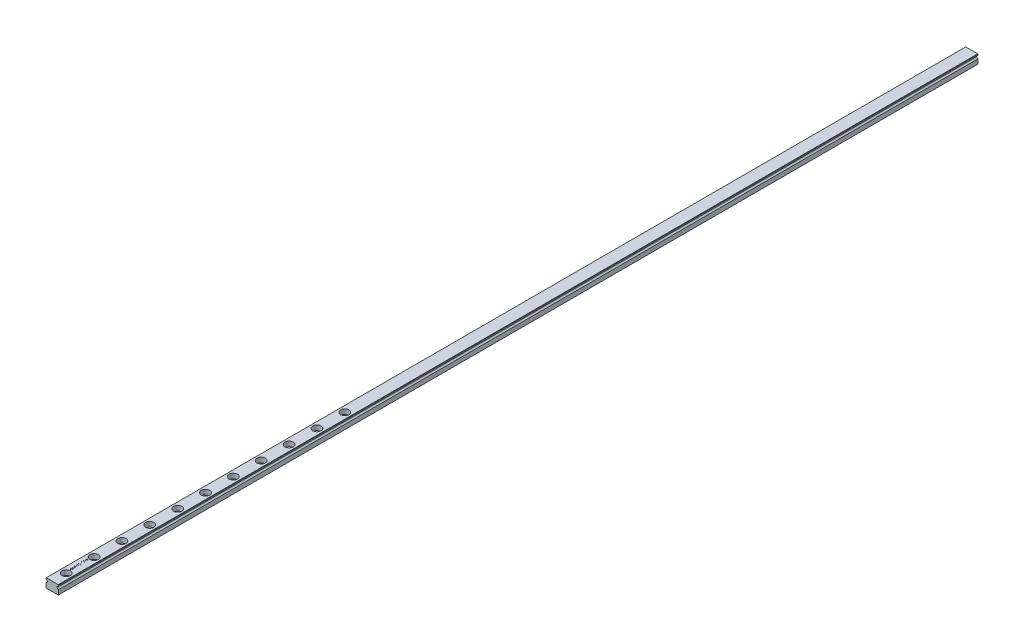
from build123d import *

# Parameters (mm, degrees)
EXTRUDE_1_DEPTH              = 220
HOLE_WIZARD_M3_1_D           = 3.5
HOLE_WIZARD_M3_1_CBORE_D     = 6
HOLE_WIZARD_M3_1_CBORE_DEPTH = 3.5
PATTERN_LINEAR_1_COUNT       = 11
PATTERN_LINEAR_1_PITCH       = 20
SKETCH_6_W                   = 1.5
SKETCH_6_H                   = 0.134615385
CUT_EXTRUDE_1_DEPTH          = 0.1
EXTRUDE_2_DEPTH              = 440


with BuildPart() as part:
    # 草图1 → 凸台-拉伸1 (new body)
    with BuildSketch(Plane.XY):
        with BuildLine():
            Line((4.5, 5.5), (4.5, 6.3))
            Line((4.5, 6.3), (4.3, 6.5))
            Line((4.3, 6.5), (-4.3, 6.5))
            Line((-4.3, 6.5), (-4.5, 6.3))
            Line((-4.5, 6.3), (-4.5, 5.5))
            ThreePointArc((-4.5, 5.5), (-3.5, 4.5), (-4.5, 3.5))
            Line((-4.5, 3.5), (-4.5, 0.2))
            Line((-4.5, 0.2), (-4.3, 0))
            Line((-4.3, 0), (0.2, 0))
            ThreePointArc((0.2, 0), (0.5, 0.3), (0.8, 0))
            Line((0.8, 0), (4.3, 0))
            Line((4.3, 0), (4.5, 0.2))
            Line((4.5, 0.2), (4.5, 3.5))
            ThreePointArc((4.5, 3.5), (3.5, 4.5), (4.5, 5.5))
        make_face()
    extrude(amount=-EXTRUDE_1_DEPTH)

    # M3 六角凹头螺钉的柱形沉头孔1 (through all)
    with Locations(Plane(origin=(0.754900713, 6.5, 19.343475793), x_dir=(-1, 0, 0), z_dir=(0, 1, 0))):
        with Locations((0.754900713, -29.343475793)):
            hole_wizard_m3_1 = CounterBoreHole(HOLE_WIZARD_M3_1_D / 2, HOLE_WIZARD_M3_1_CBORE_D / 2, HOLE_WIZARD_M3_1_CBORE_DEPTH)

    # 阵列(线性)1: M3 六角凹头螺钉的柱形沉头孔1 ×11
    with Locations(*[(0, 0, -i * PATTERN_LINEAR_1_PITCH) for i in range(1, PATTERN_LINEAR_1_COUNT)]):
        add(hole_wizard_m3_1, mode=Mode.SUBTRACT)

    # 草图6 → 切除-拉伸1 (cut)
    # profile 1 of 9: a face of its own
    with BuildSketch(Plane(origin=(0, 6.5, 0), x_dir=(1, 0, 0), z_dir=(0, 1, 0))):
        Polygon((-1.5, 13.740384615), (-1.5, 13.875), (-0.884615385, 13.875), (-0.884615385, 14.644230769), (-1.5, 14.644230769), (-1.5, 14.778846154), (0, 14.778846154), (0, 14.644230769), (-0.730769231, 14.644230769), (-0.730769231, 13.875), (0, 13.875), (0, 13.740384615), align=None)
    # profile 2 of 9: a face of its own
    with BuildSketch(Plane(origin=(0, 6.5, 0), x_dir=(1, 0, 0), z_dir=(0, 1, 0))):
        with Locations((-0.75, 15.230769231)):
            Rectangle(SKETCH_6_W, SKETCH_6_H)
    # profile 3 of 9: a face of its own
    with BuildSketch(Plane(origin=(0, 6.5, 0), x_dir=(1, 0, 0), z_dir=(0, 1, 0))):
        Polygon((-1.5, 15.528846154), (-1.5, 15.66796875), (-0.399939904, 15.961538462), (-1.5, 16.398137019), (-1.5, 16.417668269), (-0.407451923, 16.846153846), (-1.5, 17.141225962), (-1.5, 17.278846154), (0, 16.874399038), (0, 16.855168269), (-1.147235577, 16.403846154), (0, 15.947115385), (0, 15.927884615), align=None)
    # profile 4 of 9: a face of its own
    with BuildSketch(Plane(origin=(0, 6.5, 0), x_dir=(1, 0, 0), z_dir=(0, 1, 0))):
        with Locations((-0.75, 17.692307693)):
            Rectangle(SKETCH_6_W, SKETCH_6_H)
    # profile 5 of 9: a face of its own
    with BuildSketch(Plane(origin=(0, 6.5, 0), x_dir=(1, 0, 0), z_dir=(0, 1, 0))):
        Polygon((0, 18.086538462), (-1.5, 18.086538462), (-1.5, 18.114783654), (-0.319411058, 19.105769231), (-1.5, 19.105769231), (-1.5, 19.240384615), (0, 19.240384615), (0, 19.209735577), (-1.177884615, 18.221153846), (0, 18.221153846), align=None)
    # profile 6 of 9: a face of its own
    with BuildSketch(Plane(origin=(0, 6.5, 0), x_dir=(1, 0, 0), z_dir=(0, 1, 0))):
        Polygon((0, 20.125), (-1.5, 20.323016827), (-1.5, 20.342247596), (-0.269230769, 20.961538462), (-1.5, 21.579326923), (-1.5, 21.598858173), (0, 21.798076923), (0, 21.662860577), (-1.079326923, 21.519230769), (0, 20.977764423), (0, 20.947415865), (-1.081730769, 20.403846154), (0, 20.260516827), align=None)
    # profile 7 of 9: a face of its own
    with BuildSketch(Plane(origin=(0, 6.5, 0), x_dir=(1, 0, 0), z_dir=(0, 1, 0))):
        with BuildLine():
            Line((-1.243990385, 23.509615385), (-1.134615385, 23.394230769))
            add(Edge.make_bspline(
                [(-1.134615385, 23.394230769), (-1.154263766, 23.373355449), (-1.193092001, 23.332102593), (-1.243390317, 23.264731189), (-1.28690443, 23.194721537), (-1.322045397, 23.121960438), (-1.349611823, 23.048355866), (-1.369650093, 22.975173457), (-1.382340162, 22.902887044), (-1.383864341, 22.854816629), (-1.384615385, 22.831129808)],
                knots=[0, 0, 0, 0, 1.089067066, 2.152164705, 3.18986567, 4.218445106, 5.218487318, 6.173592265, 7.100032889, 8, 8, 8, 8], degree=3))
            add(Edge.make_bspline(
                [(-1.384615385, 22.831129808), (-1.384438125, 22.816594936), (-1.384084065, 22.78756289), (-1.379565116, 22.7444392), (-1.373065889, 22.701767784), (-1.363662227, 22.659629195), (-1.351744059, 22.6179415), (-1.336836002, 22.576849691), (-1.319455188, 22.536277104), (-1.299371251, 22.496605953), (-1.277308532, 22.458145638), (-1.252858892, 22.42182164), (-1.226807524, 22.387400299), (-1.198496406, 22.355536353), (-1.168203133, 22.326017847), (-1.136473262, 22.298301833), (-1.102682945, 22.272904871), (-1.066971137, 22.250282454), (-1.030168657, 22.229853485), (-0.992587626, 22.212199685), (-0.954576919, 22.196852561), (-0.915850319, 22.185163721), (-0.876807084, 22.175263346), (-0.837242608, 22.168371388), (-0.797053572, 22.164472967), (-0.770140273, 22.163799899), (-0.756610577, 22.163461538)],
                knots=[0, 0, 0, 0, 1.028150113, 2.053633673, 3.06513288, 4.081487945, 5.106702018, 6.131327874, 7.172780699, 8.228344599, 9.276313556, 10.308389736, 11.324843658, 12.329040066, 13.321460474, 14.316307835, 15.308626991, 16.309440696, 17.305625405, 18.28535951, 19.246194545, 20.203493668, 21.145557131, 22.095268976, 23.042464743, 24, 24, 24, 24], degree=3))
            add(Edge.make_bspline(
                [(-0.756610577, 22.163461538), (-0.742780294, 22.163785622), (-0.715157493, 22.164432905), (-0.673930463, 22.168569989), (-0.633320499, 22.176265079), (-0.593263727, 22.186470115), (-0.553680426, 22.199444118), (-0.514611904, 22.215383767), (-0.476061961, 22.23437211), (-0.438413282, 22.256302653), (-0.401770368, 22.280520997), (-0.36696502, 22.307157219), (-0.334402283, 22.336256163), (-0.303606537, 22.367284281), (-0.274772132, 22.40052428), (-0.248246624, 22.43629865), (-0.223619847, 22.474106619), (-0.201162346, 22.513964957), (-0.181102046, 22.555452377), (-0.163263098, 22.597990847), (-0.14857199, 22.641717091), (-0.136598507, 22.686401091), (-0.126784097, 22.731989638), (-0.120470176, 22.778714125), (-0.115888391, 22.826231), (-0.11555339, 22.858261842), (-0.115384615, 22.874399038)],
                knots=[0, 0, 0, 0, 0.935915162, 1.869274651, 2.799799983, 3.730201895, 4.664668062, 5.616159355, 6.583070886, 7.570012957, 8.562524459, 9.553461134, 10.53281078, 11.515274572, 12.509912756, 13.507571325, 14.526460018, 15.561318395, 16.601025881, 17.643204557, 18.680545676, 19.719612342, 20.772381578, 21.833430283, 22.908478249, 24, 24, 24, 24], degree=3))
            add(Edge.make_bspline(
                [(-0.115384615, 22.874399038), (-0.11579098, 22.893846981), (-0.116588941, 22.932036175), (-0.122805743, 22.988172098), (-0.132502802, 23.042091792), (-0.14674811, 23.093619722), (-0.164779159, 23.142942891), (-0.187077122, 23.189879386), (-0.213407387, 23.234558812), (-0.24323677, 23.276787781), (-0.276471827, 23.315562361), (-0.312015273, 23.350851823), (-0.350327601, 23.381442662), (-0.390837822, 23.408248655), (-0.433933425, 23.430404616), (-0.479374666, 23.448595707), (-0.527189663, 23.462538188), (-0.560228886, 23.468261798), (-0.576923077, 23.471153846)],
                knots=[0, 0, 0, 0, 1.130199668, 2.219330667, 3.279027493, 4.311506524, 5.322739849, 6.327972234, 7.327472899, 8.33386792, 9.329086447, 10.29244429, 11.240784345, 12.174119183, 13.111530729, 14.052100829, 15.015757696, 16, 16, 16, 16], degree=3))
            Line((-0.576923077, 23.471153846), (-0.576923077, 22.971153846))
            Line((-0.576923077, 22.971153846), (-0.730769231, 22.971153846))
            Line((-0.730769231, 22.971153846), (-0.730769231, 23.605769231))
            add(Edge.make_bspline(
                [(-0.730769231, 23.605769231), (-0.702094593, 23.605038153), (-0.645973146, 23.603607301), (-0.564128744, 23.593570623), (-0.48682659, 23.577363547), (-0.413985274, 23.555223413), (-0.34570802, 23.526562579), (-0.281925506, 23.491688638), (-0.223049785, 23.450043443), (-0.168600212, 23.403110397), (-0.12003055, 23.350438986), (-0.077342291, 23.293452435), (-0.041384027, 23.232056591), (-0.012129457, 23.166309531), (0.010702255, 23.096426488), (0.026890073, 23.022245754), (0.036588629, 22.943867925), (0.037827792, 22.890152206), (0.038461538, 22.862680288)],
                knots=[0, 0, 0, 0, 1.140356446, 2.231883559, 3.274166699, 4.278491846, 5.25512956, 6.21435461, 7.1637429, 8.11826594, 9.068280886, 10.0076534, 10.945064095, 11.891975133, 12.864533718, 13.863980011, 14.907571808, 16, 16, 16, 16], degree=3))
            add(Edge.make_bspline(
                [(0.038461538, 22.862680288), (0.038217629, 22.845747373), (0.037736562, 22.812350207), (0.034317699, 22.763025524), (0.029054595, 22.715060829), (0.021106685, 22.668463111), (0.011371833, 22.623060964), (-0.001093904, 22.579081142), (-0.015523346, 22.53635611), (-0.031935778, 22.494819831), (-0.050952202, 22.45484931), (-0.072084905, 22.416266517), (-0.095224917, 22.378858178), (-0.120772422, 22.342879107), (-0.148536333, 22.308141841), (-0.178572299, 22.274870365), (-0.210788493, 22.242878417), (-0.233665211, 22.222838219), (-0.245192308, 22.212740385)],
                knots=[0, 0, 0, 0, 1.107784379, 2.184907829, 3.233506516, 4.263428166, 5.276301166, 6.270063455, 7.25232949, 8.225834625, 9.190232166, 10.146266622, 11.1027726, 12.066435141, 13.031522626, 14.010570082, 14.99756817, 16, 16, 16, 16], degree=3))
            add(Edge.make_bspline(
                [(-0.245192308, 22.212740385), (-0.26347973, 22.198089271), (-0.299751023, 22.169030237), (-0.357865285, 22.131625313), (-0.418037511, 22.099738997), (-0.480435209, 22.073867073), (-0.545000015, 22.053665036), (-0.611649425, 22.039176642), (-0.680469267, 22.030687804), (-0.727040094, 22.02946486), (-0.750600962, 22.028846154)],
                knots=[0, 0, 0, 0, 1.023165419, 2.029347347, 3.013907458, 3.994755782, 4.975994455, 5.96558838, 6.970761222, 8, 8, 8, 8], degree=3))
            add(Edge.make_bspline(
                [(-0.750600962, 22.028846154), (-0.768243641, 22.029074256), (-0.803304773, 22.029527561), (-0.855357904, 22.035024211), (-0.906486775, 22.042910531), (-0.956649576, 22.054502135), (-1.005879862, 22.069114786), (-1.054200296, 22.087352121), (-1.101640133, 22.108585168), (-1.147870041, 22.133266476), (-1.192287019, 22.160724506), (-1.234673706, 22.190556358), (-1.274343142, 22.222992223), (-1.311387223, 22.258126549), (-1.346354989, 22.295251091), (-1.378516018, 22.33514522), (-1.408373576, 22.377204507), (-1.435353952, 22.421754996), (-1.459597318, 22.468093695), (-1.480849352, 22.516119874), (-1.498413761, 22.565816082), (-1.513316774, 22.616810749), (-1.524337558, 22.669489669), (-1.532329875, 22.723470616), (-1.537798704, 22.779034949), (-1.538238528, 22.816593247), (-1.538461538, 22.835637019)],
                knots=[0, 0, 0, 0, 1.00895651, 2.005089799, 2.991467152, 3.967318338, 4.948153826, 5.927364234, 6.919980553, 7.91976625, 8.923240147, 9.905815003, 10.88314567, 11.851989312, 12.825009789, 13.798721852, 14.781296708, 15.773896486, 16.776076962, 17.771600213, 18.775744723, 19.78957137, 20.808953803, 21.851964491, 22.910847925, 24, 24, 24, 24], degree=3))
            add(Edge.make_bspline(
                [(-1.538461538, 22.835637019), (-1.538213185, 22.851167695), (-1.537720729, 22.8819632), (-1.534307308, 22.927788514), (-1.528897073, 22.97290552), (-1.521514165, 23.017381116), (-1.511458298, 23.061063844), (-1.499424747, 23.104078147), (-1.485413966, 23.146486377), (-1.46870446, 23.188155626), (-1.449738621, 23.229366076), (-1.428390011, 23.270346865), (-1.404293581, 23.31095797), (-1.37737778, 23.351269819), (-1.348104887, 23.391536616), (-1.315637676, 23.431121462), (-1.281256495, 23.470979867), (-1.256535559, 23.496609216), (-1.243990385, 23.509615385)],
                knots=[0, 0, 0, 0, 0.985871117, 1.954866573, 2.915460327, 3.869826059, 4.81536089, 5.759505086, 6.70452669, 7.649098992, 8.607881297, 9.583363685, 10.581137262, 11.603961102, 12.659522466, 13.73993555, 14.853081303, 16, 16, 16, 16], degree=3))
        make_face()
    # profile 8 of 9: a face of its own
    with BuildSketch(Plane(origin=(0, 6.5, 0), x_dir=(1, 0, 0), z_dir=(0, 1, 0))):
        Polygon((0, 23.913461538), (-1.5, 23.913461538), (-1.5, 23.941706731), (-0.319411058, 24.932692308), (-1.5, 24.932692308), (-1.5, 25.067307692), (0, 25.067307692), (0, 25.036658654), (-1.177884615, 24.048076923), (0, 24.048076923), align=None)
    # profile 9 of 9: a face of its own
    with BuildSketch(Plane(origin=(0, 6.5, 0), x_dir=(1, 0, 0), z_dir=(0, 1, 0))):
        with BuildLine():
            Line((0.038461538, 25.644230769), (-0.036358173, 25.536658654))
            Line((-0.036358173, 25.536658654), (-0.646033654, 25.953725962))
            add(Edge.make_bspline(
                [(-0.646033654, 25.953725962), (-0.642627639, 25.927119325), (-0.635922786, 25.874743285), (-0.635046516, 25.821948826), (-0.634615385, 25.795973558)],
                knots=[0, 0, 0, 0, 1.015985029, 2, 2, 2, 2], degree=3))
            add(Edge.make_bspline(
                [(-0.634615385, 25.795973558), (-0.635018703, 25.780226966), (-0.635810382, 25.749317783), (-0.642085443, 25.703875646), (-0.651749784, 25.660210407), (-0.666170676, 25.61843782), (-0.684092777, 25.578400913), (-0.706317169, 25.540186946), (-0.732462883, 25.503847908), (-0.762390698, 25.469771994), (-0.79525498, 25.438786105), (-0.830027824, 25.411158608), (-0.867084601, 25.38832306), (-0.905643777, 25.369014905), (-0.946528356, 25.354782526), (-0.989044603, 25.344167996), (-1.033456433, 25.33770465), (-1.063680548, 25.336931181), (-1.079026442, 25.336538462)],
                knots=[0, 0, 0, 0, 1.060698949, 2.082059282, 3.085738422, 4.069684654, 5.054463875, 6.037298355, 7.043153692, 8.066652628, 9.088369706, 10.083456696, 11.053578809, 12.016466116, 12.983507685, 13.964045196, 14.966270913, 16, 16, 16, 16], degree=3))
            add(Edge.make_bspline(
                [(-1.079026442, 25.336538462), (-1.100012199, 25.337283285), (-1.141202981, 25.338745222), (-1.201400397, 25.350466182), (-1.258351131, 25.369885651), (-1.3119915, 25.396537862), (-1.361089385, 25.43075081), (-1.405478439, 25.47138122), (-1.444366827, 25.518757479), (-1.477757084, 25.571642671), (-1.504794475, 25.628718475), (-1.524003389, 25.688742519), (-1.536274492, 25.750703662), (-1.537729379, 25.792811829), (-1.538461538, 25.814002404)],
                knots=[0, 0, 0, 0, 1.023011052, 2.007963168, 2.978169221, 3.950402619, 4.919353283, 5.887490769, 6.876420893, 7.899700203, 8.931203047, 9.947778163, 10.96723692, 12, 12, 12, 12], degree=3))
            add(Edge.make_bspline(
                [(-1.538461538, 25.814002404), (-1.537677179, 25.834783148), (-1.536127357, 25.875843941), (-1.524777147, 25.936225043), (-1.505646911, 25.994056533), (-1.479211547, 26.04902008), (-1.446070758, 26.099903164), (-1.406596454, 26.145683388), (-1.360755672, 26.185145911), (-1.309807647, 26.21879079), (-1.25472961, 26.245295182), (-1.197347446, 26.264716171), (-1.138006313, 26.276587527), (-1.097810064, 26.2780886), (-1.077524038, 26.278846154)],
                knots=[0, 0, 0, 0, 1.026358223, 2.027987109, 3.023239252, 4.028077889, 5.032770297, 6.015020143, 7.004250571, 8.011656937, 9.02310243, 10.015224881, 10.998334443, 12, 12, 12, 12], degree=3))
            add(Edge.make_bspline(
                [(-1.077524038, 26.278846154), (-1.061777289, 26.278338872), (-1.029838946, 26.277309978), (-0.981399024, 26.270187018), (-0.932048608, 26.257900384), (-0.890237555, 26.244171772), (-0.855599349, 26.230715419), (-0.828157364, 26.218414328), (-0.799474135, 26.204124912), (-0.769432207, 26.188166246), (-0.737992383, 26.170568563), (-0.705372722, 26.150853478), (-0.671525668, 26.129286907), (-0.648704972, 26.113932306), (-0.637019231, 26.106069712)],
                knots=[0, 0, 0, 0, 1.179894106, 2.393120058, 3.660107319, 4.986885617, 5.687958251, 6.443931318, 7.239444731, 8.088894906, 8.992865148, 9.938946712, 10.944601238, 12, 12, 12, 12], degree=3))
            Line((-0.637019231, 26.106069712), (0.038461538, 25.644230769))
        make_face()
        with BuildLine():
            add(Edge.make_bspline(
                [(-0.788461538, 25.820913462), (-0.788788092, 25.832842038), (-0.789423782, 25.856062922), (-0.793275522, 25.890085737), (-0.800155229, 25.922181807), (-0.809870336, 25.952557703), (-0.822177437, 25.981176653), (-0.837175655, 26.008047671), (-0.855193568, 26.032896281), (-0.875446063, 26.05581095), (-0.897641992, 26.076606708), (-0.92142287, 26.094537445), (-0.946049906, 26.110062218), (-0.972027251, 26.122447516), (-0.998929945, 26.132428799), (-1.027147055, 26.139393389), (-1.056483756, 26.143240028), (-1.076411522, 26.143896939), (-1.086538462, 26.144230769)],
                knots=[0, 0, 0, 0, 1.163726718, 2.265380301, 3.334713825, 4.36057981, 5.371541381, 6.368955992, 7.355979581, 8.359691305, 9.348261197, 10.317521986, 11.261029684, 12.183096459, 13.119698615, 14.055740009, 15.011961376, 16, 16, 16, 16], degree=3))
            add(Edge.make_bspline(
                [(-1.086538462, 26.144230769), (-1.096669885, 26.143944046), (-1.116635099, 26.143379024), (-1.146011565, 26.138837612), (-1.174173238, 26.130870253), (-1.201311834, 26.120071794), (-1.227278993, 26.10611642), (-1.252156559, 26.089207568), (-1.27556797, 26.06878977), (-1.297899065, 26.04597379), (-1.318157147, 26.020878942), (-1.336055672, 25.994290795), (-1.351161049, 25.966351386), (-1.363089133, 25.93693608), (-1.37286104, 25.906444325), (-1.379778661, 25.87456046), (-1.383632614, 25.841240421), (-1.384283622, 25.818619358), (-1.384615385, 25.807091346)],
                knots=[0, 0, 0, 0, 0.971910406, 1.91526867, 2.84337505, 3.775008003, 4.712374136, 5.666733183, 6.654995996, 7.688089235, 8.726800303, 9.745078658, 10.75990398, 11.768337501, 12.786615857, 13.829099629, 14.893678693, 16, 16, 16, 16], degree=3))
            add(Edge.make_bspline(
                [(-1.384615385, 25.807091346), (-1.384283077, 25.795663594), (-1.383631091, 25.773242439), (-1.379786064, 25.740218598), (-1.372814047, 25.708550372), (-1.363093561, 25.678147127), (-1.351160136, 25.648732673), (-1.336054875, 25.620794582), (-1.318161301, 25.594200241), (-1.297882935, 25.569129265), (-1.275672102, 25.546272163), (-1.252051947, 25.526199864), (-1.227292163, 25.509252774), (-1.201308356, 25.495316895), (-1.174174163, 25.48451328), (-1.146011315, 25.476547297), (-1.116635164, 25.472005515), (-1.096669907, 25.471440543), (-1.086538462, 25.471153846)],
                knots=[0, 0, 0, 0, 1.099107991, 2.156440826, 3.191784126, 4.212280276, 5.222910149, 6.239945746, 7.260441896, 8.30141526, 9.33675856, 10.320924759, 11.277362386, 12.216770088, 13.150432123, 14.080559904, 15.025972789, 16, 16, 16, 16], degree=3))
            add(Edge.make_bspline(
                [(-1.086538462, 25.471153846), (-1.076403667, 25.471413811), (-1.056415996, 25.471926509), (-1.02704542, 25.476862927), (-0.998901248, 25.485140198), (-0.971743232, 25.496115903), (-0.945922725, 25.510845615), (-0.921305837, 25.528746476), (-0.897389308, 25.549401013), (-0.875515463, 25.573486122), (-0.855096635, 25.599349364), (-0.837288944, 25.627129241), (-0.822356647, 25.656267501), (-0.809834058, 25.686577057), (-0.800253227, 25.718284705), (-0.793288301, 25.751346293), (-0.789460709, 25.785767775), (-0.788797791, 25.809085836), (-0.788461538, 25.820913462)],
                knots=[0, 0, 0, 0, 0.952872936, 1.879239831, 2.791748947, 3.708674669, 4.628500839, 5.580394867, 6.568761142, 7.595635223, 8.636123962, 9.665976811, 10.694276597, 11.712685318, 12.747011694, 13.805940053, 14.887106426, 16, 16, 16, 16], degree=3))
        make_face(mode=Mode.SUBTRACT)
    extrude(amount=-CUT_EXTRUDE_1_DEPTH, mode=Mode.SUBTRACT)

    # 草图7 → 凸台-拉伸2 (add)
    with BuildSketch(Plane(origin=(0, 0, -220), x_dir=(-1, 0, 0), z_dir=(0, 0, -1))):
        with BuildLine():
            Line((-4.3, 0), (-0.8, 0))
            ThreePointArc((-0.8, 0), (-0.5, 0.3), (-0.2, 0))
            Line((-0.2, 0), (4.3, 0))
            Line((4.3, 0), (4.5, 0.2))
            Line((4.5, 0.2), (4.5, 3.5))
            ThreePointArc((4.5, 3.5), (3.5, 4.5), (4.5, 5.5))
            Line((4.5, 5.5), (4.5, 6.3))
            Line((4.5, 6.3), (4.3, 6.5))
            Line((4.3, 6.5), (-4.3, 6.5))
            Line((-4.3, 6.5), (-4.5, 6.3))
            Line((-4.5, 6.3), (-4.5, 5.5))
            ThreePointArc((-4.5, 5.5), (-3.5, 4.5), (-4.5, 3.5))
            Line((-4.5, 3.5), (-4.5, 0.2))
            Line((-4.5, 0.2), (-4.3, 0))
        make_face()
    extrude(amount=EXTRUDE_2_DEPTH)


solid = part.part
